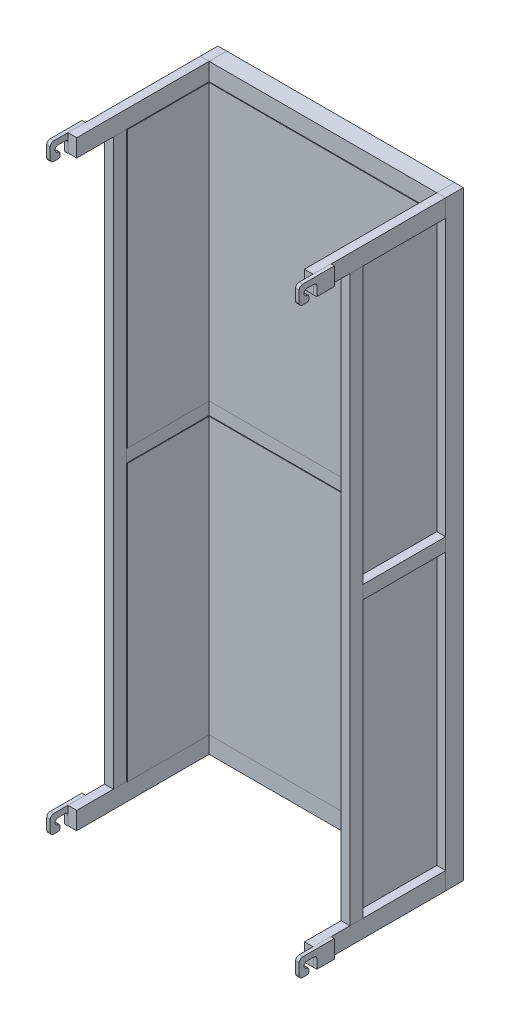
from build123d import *

# Parameters (mm, degrees)
SKETCH12_W             = 50
SKETCH12_H             = 100
BOSS_EXTRUDE1_DEPTH    = 3400
BOSS_EXTRUDE1_2_DEPTH  = 3400
BOSS_EXTRUDE2_REACH    = 3657.899
SKETCH13_W             = 100
SKETCH13_H             = 100
SKETCH13_H_2           = 200
SKETCH13_H_3           = 75
SKETCH14_W             = 50
SKETCH14_H             = 100
BOSS_EXTRUDE3_DEPTH    = 750
BOSS_EXTRUDE3_2_DEPTH  = 750
BOSS_EXTRUDE3_3_DEPTH  = 750
BOSS_EXTRUDE3_4_DEPTH  = 750
SKETCH15_W             = 50
SKETCH15_H             = 75
BOSS_EXTRUDE4_DEPTH    = 467
BOSS_EXTRUDE4_2_DEPTH  = 467
SKETCH16_W             = 50
SKETCH16_H             = 75
BOSS_EXTRUDE5_DEPTH    = 3200
BOSS_EXTRUDE5_2_DEPTH  = 3200
BOSS_EXTRUDE6_DEPTH    = 20
BOSS_EXTRUDE6_2_DEPTH  = 20
BOSS_EXTRUDE7_DEPTH    = 20
BOSS_EXTRUDE7_2_DEPTH  = 20
SKETCH19_W             = 467
SKETCH19_H             = 1562.5
BOSS_EXTRUDE8_DEPTH    = 4
BOSS_EXTRUDE8_2_DEPTH  = 4
SKETCH21_W             = 467
SKETCH21_H             = 1562.5
BOSS_EXTRUDE10_DEPTH   = 4
BOSS_EXTRUDE10_2_DEPTH = 4
SKETCH22_W             = 1282
SKETCH22_H             = 1562.5
BOSS_EXTRUDE11_DEPTH   = 4
BOSS_EXTRUDE11_2_DEPTH = 4


with BuildPart() as part:
    # Sketch12 → Boss-Extrude1 (new body)
    with BuildSketch(Plane(origin=(0, 0, 0), x_dir=(1, 0, 0), z_dir=(0, 1, 0))):
        with Locations((-25, -50)):
            Rectangle(SKETCH12_W, SKETCH12_H)
    extrude(amount=BOSS_EXTRUDE1_DEPTH)


with BuildPart() as body_2:
    # Sketch12 → Boss-Extrude1 2 (new body)
    with BuildSketch(Plane(origin=(0, 0, 0), x_dir=(1, 0, 0), z_dir=(0, 1, 0))):
        with Locations((-1365, -50)):
            Rectangle(SKETCH12_W, SKETCH12_H)
    extrude(amount=BOSS_EXTRUDE1_2_DEPTH)


with BuildPart() as body_3:

    # Sketch13 → Boss-Extrude2 (new, up to next)
    with BuildSketch(Plane(origin=(-1340, 0, 0), x_dir=(0, 0, -1), z_dir=(1, 0, 0)), mode=Mode.PRIVATE) as boss_extrude2_sk1:
        with Locations((-50, 50)):
            Rectangle(SKETCH13_W, SKETCH13_H)
    boss_extrude2_tool1 = extrude(boss_extrude2_sk1.sketch, amount=BOSS_EXTRUDE2_REACH, mode=Mode.PRIVATE) - part.part
    # Sketch13 → Boss-Extrude2 (new, up to next)
    with BuildSketch(Plane(origin=(-1340, 0, 0), x_dir=(0, 0, -1), z_dir=(1, 0, 0)), mode=Mode.PRIVATE) as boss_extrude2_sk2:
        with Locations((-50, 3350)):
            Rectangle(SKETCH13_W, SKETCH13_H)
    boss_extrude2_tool2 = extrude(boss_extrude2_sk2.sketch, amount=BOSS_EXTRUDE2_REACH, mode=Mode.PRIVATE) - part.part
    # Sketch13 → Boss-Extrude2 (new, up to next)
    with BuildSketch(Plane(origin=(-1340, 0, 0), x_dir=(0, 0, -1), z_dir=(1, 0, 0)), mode=Mode.PRIVATE) as boss_extrude2_sk3:
        with Locations((-50, 1200)):
            Rectangle(SKETCH13_W, SKETCH13_H_2)
    boss_extrude2_tool3 = extrude(boss_extrude2_sk3.sketch, amount=BOSS_EXTRUDE2_REACH, mode=Mode.PRIVATE) - part.part
    # Sketch13 → Boss-Extrude2 (new, up to next)
    with BuildSketch(Plane(origin=(-1340, 0, 0), x_dir=(0, 0, -1), z_dir=(1, 0, 0)), mode=Mode.PRIVATE) as boss_extrude2_sk4:
        with Locations((-50, 2200)):
            Rectangle(SKETCH13_W, SKETCH13_H_2)
    boss_extrude2_tool4 = extrude(boss_extrude2_sk4.sketch, amount=BOSS_EXTRUDE2_REACH, mode=Mode.PRIVATE) - part.part
    # Sketch13 → Boss-Extrude2 (new, up to next)
    with BuildSketch(Plane(origin=(-1340, 0, 0), x_dir=(0, 0, -1), z_dir=(1, 0, 0)), mode=Mode.PRIVATE) as boss_extrude2_sk5:
        with Locations((-50, 1700)):
            Rectangle(SKETCH13_W, SKETCH13_H_3)
    boss_extrude2_tool5 = extrude(boss_extrude2_sk5.sketch, amount=BOSS_EXTRUDE2_REACH, mode=Mode.PRIVATE) - part.part
    add(boss_extrude2_tool1.solids().sort_by_distance((-1340, 50, 50))[0])
    add(boss_extrude2_tool2.solids().sort_by_distance((-1340, 3350, 50))[0])
    add(boss_extrude2_tool3.solids().sort_by_distance((-1340, 1200, 50))[0])
    add(boss_extrude2_tool4.solids().sort_by_distance((-1340, 2200, 50))[0])
    add(boss_extrude2_tool5.solids().sort_by_distance((-1340, 1700, 50))[0])


with BuildPart() as body_4:
    # Sketch14 → Boss-Extrude3 (new body)
    with BuildSketch(Plane.XY.offset(100)):
        with Locations((-1365, 50)):
            Rectangle(SKETCH14_W, SKETCH14_H)
    extrude(amount=BOSS_EXTRUDE3_DEPTH)


with BuildPart() as body_5:
    # Sketch14 → Boss-Extrude3 2 (new body)
    with BuildSketch(Plane.XY.offset(100)):
        with Locations((-25, 50)):
            Rectangle(SKETCH14_W, SKETCH14_H)
    extrude(amount=BOSS_EXTRUDE3_2_DEPTH)


with BuildPart() as body_6:
    # Sketch14 → Boss-Extrude3 3 (new body)
    with BuildSketch(Plane.XY.offset(100)):
        with Locations((-1365, 3350)):
            Rectangle(SKETCH14_W, SKETCH14_H)
    extrude(amount=BOSS_EXTRUDE3_3_DEPTH)


with BuildPart() as body_7:
    # Sketch14 → Boss-Extrude3 4 (new body)
    with BuildSketch(Plane.XY.offset(100)):
        with Locations((-25, 3350)):
            Rectangle(SKETCH14_W, SKETCH14_H)
    extrude(amount=BOSS_EXTRUDE3_4_DEPTH)


with BuildPart() as body_8:
    # Sketch15 → Boss-Extrude4 (new body)
    with BuildSketch(Plane.XY.offset(100)):
        with Locations((-1365, 1700)):
            Rectangle(SKETCH15_W, SKETCH15_H)
    extrude(amount=BOSS_EXTRUDE4_DEPTH)


with BuildPart() as body_9:
    # Sketch15 → Boss-Extrude4 2 (new body)
    with BuildSketch(Plane.XY.offset(100)):
        with Locations((-25, 1700)):
            Rectangle(SKETCH15_W, SKETCH15_H)
    extrude(amount=BOSS_EXTRUDE4_2_DEPTH)


with BuildPart() as body_10:
    # Sketch16 → Boss-Extrude5 (new body)
    with BuildSketch(Plane.XZ.offset(-3300)):
        with Locations((-25, 604.5)):
            Rectangle(SKETCH16_W, SKETCH16_H)
    extrude(amount=BOSS_EXTRUDE5_DEPTH)


with BuildPart() as body_11:
    # Sketch16 → Boss-Extrude5 2 (new body)
    with BuildSketch(Plane.XZ.offset(-3300)):
        with Locations((-1365, 604.5)):
            Rectangle(SKETCH16_W, SKETCH16_H)
    extrude(amount=BOSS_EXTRUDE5_2_DEPTH)


with BuildPart() as body_12:
    # Sketch17 → Boss-Extrude6 (new body)
    with BuildSketch(Plane(origin=(0, 0, 0), x_dir=(0, 0, -1), z_dir=(1, 0, 0))):
        with BuildLine():
            Line((-850, 0), (-850, 54.1))
            ThreePointArc((-850, 54.1), (-854.393398282, 64.706601718), (-865, 69.1))
            Line((-865, 69.1), (-905, 69.1))
            ThreePointArc((-905, 69.1), (-922.5, 51.6), (-905, 34.1))
            ThreePointArc((-905, 34.1), (-897.928932188, 31.171067812), (-895, 24.1))
            Line((-895, 24.1), (-895, 10))
            ThreePointArc((-895, 10), (-897.928932188, 2.928932188), (-905, 0))
            Line((-905, 0), (-930, 0))
            ThreePointArc((-930, 0), (-944.142135624, 5.857864376), (-950, 20))
            Line((-950, 20), (-950, 81.6))
            ThreePointArc((-950, 81.6), (-944.142135624, 95.742135624), (-930, 101.6))
            Line((-930, 101.6), (-750, 101.6))
            Line((-750, 101.6), (-750, 0))
            Line((-750, 0), (-850, 0))
        make_face()
    extrude(amount=BOSS_EXTRUDE6_DEPTH)


with BuildPart() as body_13:
    # Sketch17 → Boss-Extrude6 2 (new body)
    with BuildSketch(Plane(origin=(0, 0, 0), x_dir=(0, 0, -1), z_dir=(1, 0, 0))):
        with BuildLine():
            Line((-905, 3369.1), (-865, 3369.1))
            ThreePointArc((-865, 3369.1), (-854.393398282, 3364.706601718), (-850, 3354.1))
            Line((-850, 3354.1), (-850, 3300))
            Line((-850, 3300), (-750, 3300))
            Line((-750, 3300), (-750, 3401.6))
            Line((-750, 3401.6), (-930, 3401.6))
            ThreePointArc((-930, 3401.6), (-944.142135624, 3395.742135624), (-950, 3381.6))
            Line((-950, 3381.6), (-950, 3320))
            ThreePointArc((-950, 3320), (-944.142135624, 3305.857864376), (-930, 3300))
            Line((-930, 3300), (-905, 3300))
            ThreePointArc((-905, 3300), (-897.928932188, 3302.928932188), (-895, 3310))
            Line((-895, 3310), (-895, 3324.1))
            ThreePointArc((-895, 3324.1), (-897.928932188, 3331.171067812), (-905, 3334.1))
            ThreePointArc((-905, 3334.1), (-922.5, 3351.6), (-905, 3369.1))
        make_face()
    extrude(amount=BOSS_EXTRUDE6_2_DEPTH)


with BuildPart() as body_14:
    # Sketch18 → Boss-Extrude7 (new body)
    with BuildSketch(Plane.ZY.offset(1390)):
        with BuildLine():
            Line((950, 3318.4), (950, 3380))
            ThreePointArc((950, 3380), (944.142135624, 3394.142135624), (930, 3400))
            Line((930, 3400), (750, 3400))
            Line((750, 3400), (750, 3298.4))
            Line((750, 3298.4), (850, 3298.4))
            Line((850, 3298.4), (850, 3352.5))
            ThreePointArc((850, 3352.5), (854.393398282, 3363.106601718), (865, 3367.5))
            Line((865, 3367.5), (905, 3367.5))
            ThreePointArc((905, 3367.5), (922.5, 3350), (905, 3332.5))
            ThreePointArc((905, 3332.5), (897.928932188, 3329.571067812), (895, 3322.5))
            Line((895, 3322.5), (895, 3308.4))
            ThreePointArc((895, 3308.4), (897.928932188, 3301.328932188), (905, 3298.4))
            Line((905, 3298.4), (930, 3298.4))
            ThreePointArc((930, 3298.4), (944.142135624, 3304.257864376), (950, 3318.4))
        make_face()
    extrude(amount=BOSS_EXTRUDE7_DEPTH)


with BuildPart() as body_15:
    # Sketch18 → Boss-Extrude7 2 (new body)
    with BuildSketch(Plane.ZY.offset(1390)):
        with BuildLine():
            Line((950, 18.4), (950, 80))
            ThreePointArc((950, 80), (944.142135624, 94.142135624), (930, 100))
            Line((930, 100), (750, 100))
            Line((750, 100), (750, -1.6))
            Line((750, -1.6), (850, -1.6))
            Line((850, -1.6), (850, 52.5))
            ThreePointArc((850, 52.5), (854.393398282, 63.106601718), (865, 67.5))
            Line((865, 67.5), (905, 67.5))
            ThreePointArc((905, 67.5), (922.5, 50), (905, 32.5))
            ThreePointArc((905, 32.5), (897.928932188, 29.571067812), (895, 22.5))
            Line((895, 22.5), (895, 8.4))
            ThreePointArc((895, 8.4), (897.928932188, 1.328932188), (905, -1.6))
            Line((905, -1.6), (930, -1.6))
            ThreePointArc((930, -1.6), (944.142135624, 4.257864376), (950, 18.4))
        make_face()
    extrude(amount=BOSS_EXTRUDE7_2_DEPTH)


with BuildPart() as body_16:
    # Sketch19 → Boss-Extrude8 (new body)
    with BuildSketch(Plane.ZY.offset(50)):
        with Locations((333.5, 2518.75)):
            Rectangle(SKETCH19_W, SKETCH19_H)
    extrude(amount=BOSS_EXTRUDE8_DEPTH)


with BuildPart() as body_17:
    # Sketch19 → Boss-Extrude8 2 (new body)
    with BuildSketch(Plane.ZY.offset(50)):
        with Locations((333.5, 881.25)):
            Rectangle(SKETCH19_W, SKETCH19_H)
    extrude(amount=BOSS_EXTRUDE8_2_DEPTH)


with BuildPart() as body_18:
    # Sketch21 → Boss-Extrude10 (new body)
    with BuildSketch(Plane(origin=(-1340, 0, 0), x_dir=(0, 0, -1), z_dir=(1, 0, 0))):
        with Locations((-333.5, 881.25)):
            Rectangle(SKETCH21_W, SKETCH21_H)
    extrude(amount=BOSS_EXTRUDE10_DEPTH)


with BuildPart() as body_19:
    # Sketch21 → Boss-Extrude10 2 (new body)
    with BuildSketch(Plane(origin=(-1340, 0, 0), x_dir=(0, 0, -1), z_dir=(1, 0, 0))):
        with Locations((-333.5, 2518.75)):
            Rectangle(SKETCH21_W, SKETCH21_H)
    extrude(amount=BOSS_EXTRUDE10_2_DEPTH)


with BuildPart() as body_20:
    # Sketch22 → Boss-Extrude11 (new body)
    with BuildSketch(Plane.XY.offset(100)):
        with Locations((-695, 881.25)):
            Rectangle(SKETCH22_W, SKETCH22_H)
    extrude(amount=BOSS_EXTRUDE11_DEPTH)


with BuildPart() as body_21:
    # Sketch22 → Boss-Extrude11 2 (new body)
    with BuildSketch(Plane.XY.offset(100)):
        with Locations((-695, 2518.75)):
            Rectangle(SKETCH22_W, SKETCH22_H)
    extrude(amount=BOSS_EXTRUDE11_2_DEPTH)


solid = Compound([part.part, body_2.part, body_3.part, body_4.part, body_5.part, body_6.part, body_7.part, body_8.part, body_9.part, body_10.part, body_11.part, body_12.part, body_13.part, body_14.part, body_15.part, body_16.part, body_17.part, body_18.part, body_19.part, body_20.part, body_21.part])
